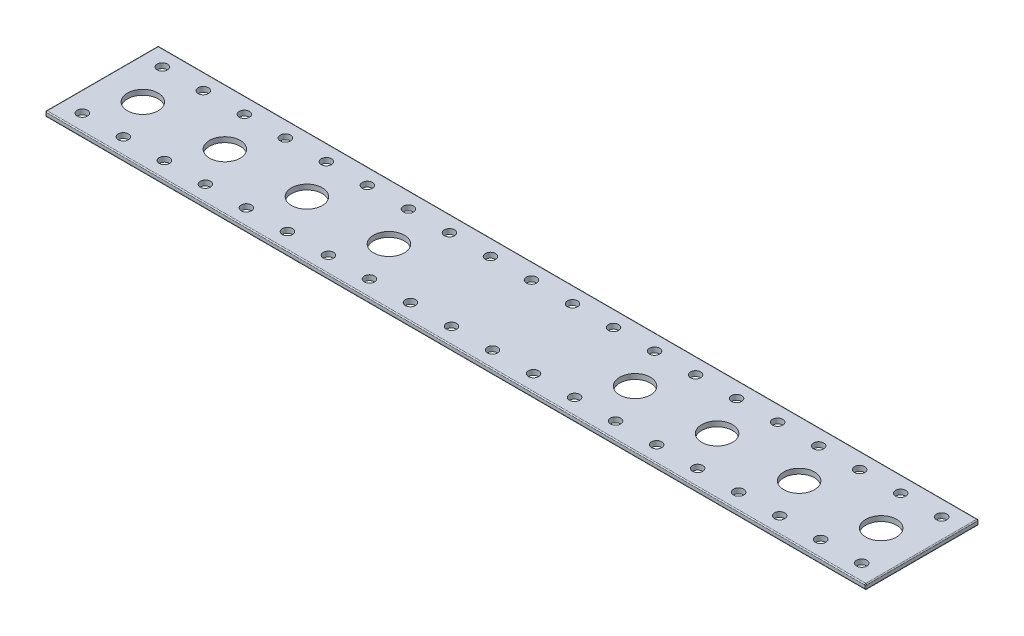
from build123d import *

# Parameters (mm, degrees)
SKETCH1_W               = 400
SKETCH1_H               = 55
BOSS_EXTRUDE1_DEPTH     = 2.5
SKETCH2_R               = 2.5
CUT_EXTRUDE1_DEPTH      = 2.5
LPATTERN1_COUNT         = 10
LPATTERN1_PITCH         = 40
SKETCH3_R               = 7.5
CUT_EXTRUDE2_DEPTH      = 2.5
LPATTERN2_COUNT         = 4
LPATTERN2_PITCH         = 40
MIRROR1_COPY_1_SKETCH_R = 7.5
MIRROR1_COPY_1_DEPTH    = 2.5
MIRROR1_COPY_2_SKETCH_R = 7.5
MIRROR1_COPY_2_DEPTH    = 2.5
MIRROR1_COPY_3_SKETCH_R = 7.5
MIRROR1_COPY_3_DEPTH    = 2.5
FILLET1_R               = 0.5


with BuildPart() as part:
    # Sketch1 → Boss-Extrude1 (new body)
    with BuildSketch(Plane(origin=(0, 0, 0), x_dir=(1, 0, 0), z_dir=(0, 1, 0))):
        Rectangle(SKETCH1_W, SKETCH1_H)
    extrude(amount=BOSS_EXTRUDE1_DEPTH)

    # Sketch2 → Cut-Extrude1 (cut)
    with BuildSketch(Plane(origin=(0, 2.5, 0), x_dir=(1, 0, 0), z_dir=(0, 1, 0))):
        with Locations(Location((-190, 19.5, 0), (0, 0, 270))):
            Circle(SKETCH2_R)
        with Locations(Location((-170, 19.5, 0), (0, 0, 270))):
            Circle(SKETCH2_R)
        with Locations(Location((-190, -19.5, 0), (0, 0, 270))):
            Circle(SKETCH2_R)
        with Locations(Location((-170, -19.5, 0), (0, 0, 270))):
            Circle(SKETCH2_R)
    cut_extrude1 = extrude(amount=-CUT_EXTRUDE1_DEPTH, mode=Mode.SUBTRACT)

    # LPattern1: Cut-Extrude1 ×10
    with Locations(*[(i * LPATTERN1_PITCH, 0, 0) for i in range(1, LPATTERN1_COUNT)]):
        add(cut_extrude1, mode=Mode.SUBTRACT)

    # Sketch3 → Cut-Extrude2 (cut)
    with BuildSketch(Plane(origin=(0, 2.5, 0), x_dir=(1, 0, 0), z_dir=(0, 1, 0))):
        with Locations(Location((-180, 0, 0), (0, 0, 270))):
            Circle(SKETCH3_R)
    cut_extrude2 = extrude(amount=-CUT_EXTRUDE2_DEPTH, mode=Mode.SUBTRACT)

    # LPattern2: Cut-Extrude2 ×4
    with Locations(*[(i * LPATTERN2_PITCH, 0, 0) for i in range(1, LPATTERN2_COUNT)]):
        add(cut_extrude2, mode=Mode.SUBTRACT)

    # Mirror1: Cut-Extrude2 across plane
    add(cut_extrude2.mirror(Plane(origin=(0, 0, 0), x_dir=(0, 0, 1), z_dir=(1, 0, 0))), mode=Mode.SUBTRACT)

    # Mirror1 copy 1 sketch → Mirror1 copy 1 (cut)
    with BuildSketch(Plane(origin=(-40, 2.5, 0), x_dir=(-1, 0, 0), z_dir=(0, 1, 0))):
        with Locations((-180, 0)):
            Circle(MIRROR1_COPY_1_SKETCH_R)
    extrude(amount=-MIRROR1_COPY_1_DEPTH, mode=Mode.SUBTRACT)

    # Mirror1 copy 2 sketch → Mirror1 copy 2 (cut)
    with BuildSketch(Plane(origin=(-80, 2.5, 0), x_dir=(-1, 0, 0), z_dir=(0, 1, 0))):
        with Locations((-180, 0)):
            Circle(MIRROR1_COPY_2_SKETCH_R)
    extrude(amount=-MIRROR1_COPY_2_DEPTH, mode=Mode.SUBTRACT)

    # Mirror1 copy 3 sketch → Mirror1 copy 3 (cut)
    with BuildSketch(Plane(origin=(-120, 2.5, 0), x_dir=(-1, 0, 0), z_dir=(0, 1, 0))):
        with Locations((-180, 0)):
            Circle(MIRROR1_COPY_3_SKETCH_R)
    extrude(amount=-MIRROR1_COPY_3_DEPTH, mode=Mode.SUBTRACT)

    # Fillet1
    fillet1_edges = [part.edges().sort_by_distance(p)[0] for p in [
        (-200, 2.5, 0),
        (0, 2.5, 27.5),
        (200, 2.5, 0),
        (0, 0, 27.5),
        (-200, 0, 0),
        (0, 0, -27.5),
        (200, 0, 0),
        (200, 1.25, 27.5),
        (-200, 1.25, 27.5),
        (-200, 1.25, -27.5),
        (200, 1.25, -27.5),
        (0, 2.5, -27.5),
    ]]
    fillet(fillet1_edges, radius=FILLET1_R)


solid = part.part
